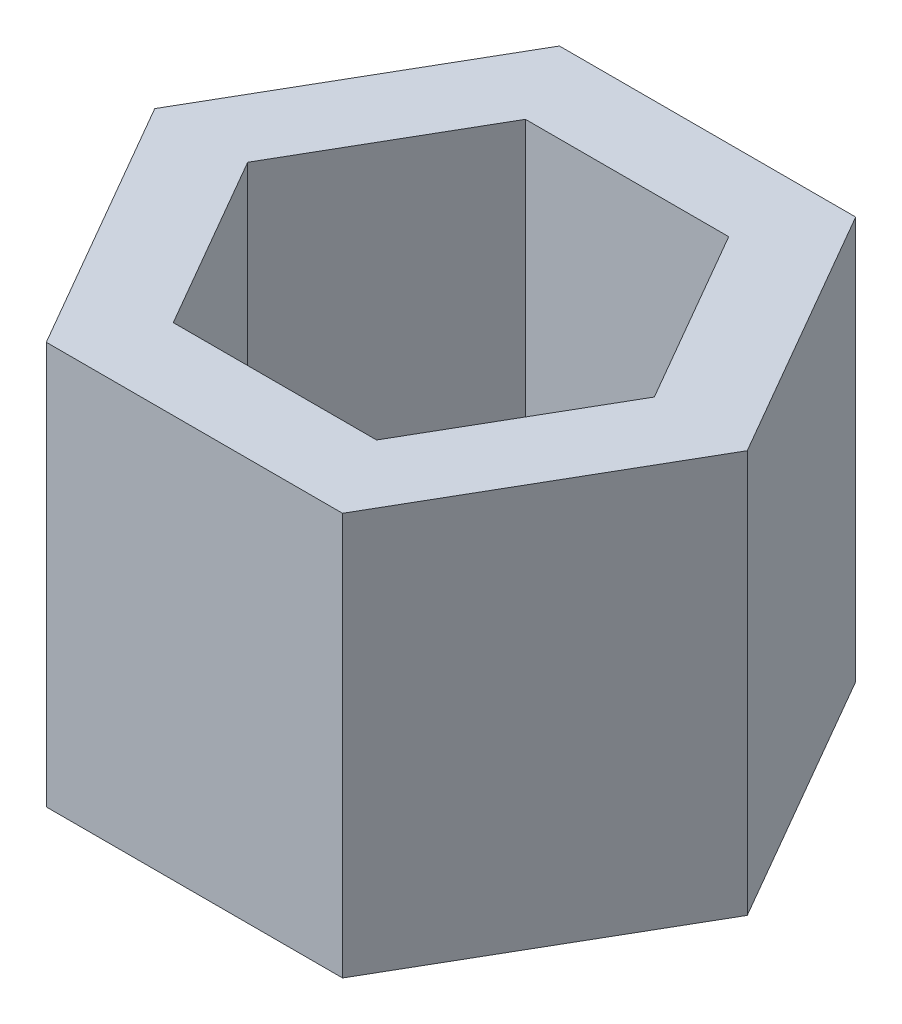
from build123d import *

# Parameters (mm, degrees)
BOSS_EXTRUDE1_DEPTH = 10


with BuildPart() as part:
    # Sketch1 → Boss-Extrude1 (new body)
    with BuildSketch(Plane(origin=(0, 0, 0), x_dir=(1, 0, 0), z_dir=(0, 1, 0))):
        Polygon((7.361215932, 0), (3.680607966, 6.375), (-3.680607966, 6.375), (-7.361215932, 0), (-3.680607966, -6.375), (3.680607966, -6.375), align=None)
        Polygon((2.525907428, 4.375), (-2.525907428, 4.375), (-5.051814855, 0), (-2.525907428, -4.375), (2.525907428, -4.375), (5.051814855, 0), align=None, mode=Mode.SUBTRACT)
    extrude(amount=BOSS_EXTRUDE1_DEPTH)


solid = part.part
